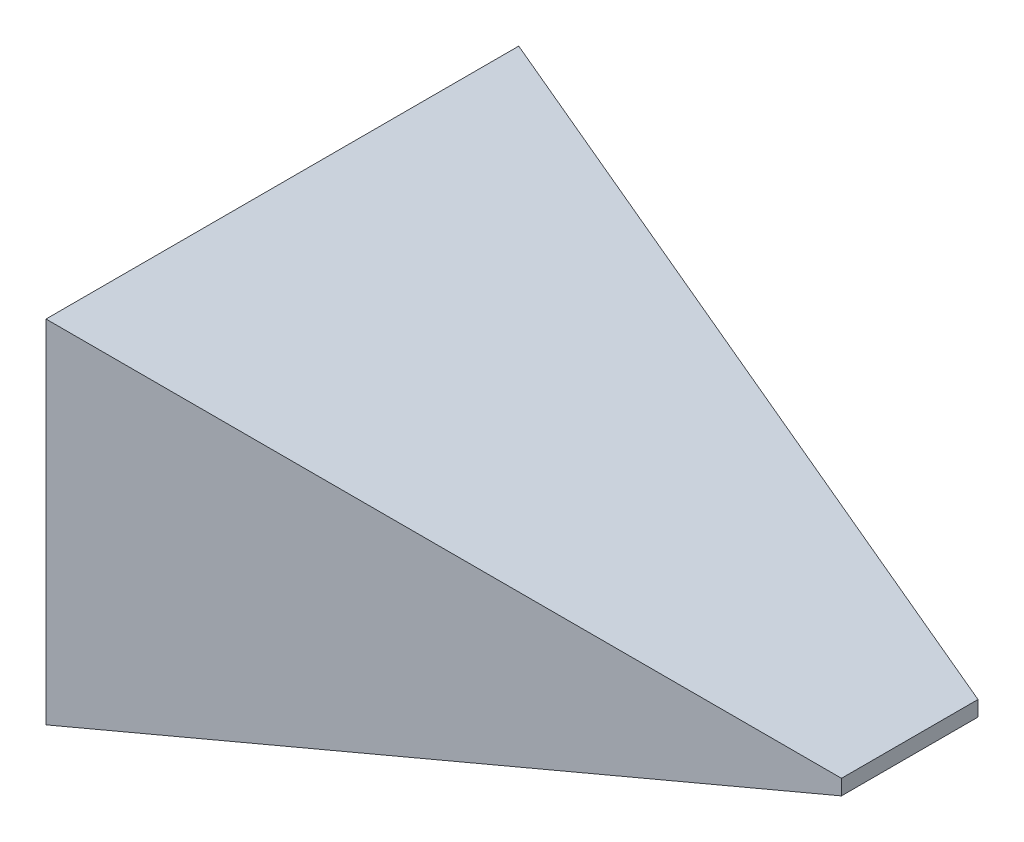
from build123d import *

# Parameters (mm, degrees)
SKETCH1_W           = 68.326
SKETCH1_H           = 50.8
BOSS_EXTRUDE1_DEPTH = 90.678
BOSS_EXTRUDE1_TAPER = 15


with BuildPart() as part:
    # Sketch1 → Boss-Extrude1 (new body)
    with BuildSketch(Plane(origin=(0, 0, 0), x_dir=(0, 0, -1), z_dir=(1, 0, 0))):
        Rectangle(SKETCH1_W, SKETCH1_H)
    extrude(amount=BOSS_EXTRUDE1_DEPTH, taper=BOSS_EXTRUDE1_TAPER)


solid = part.part
